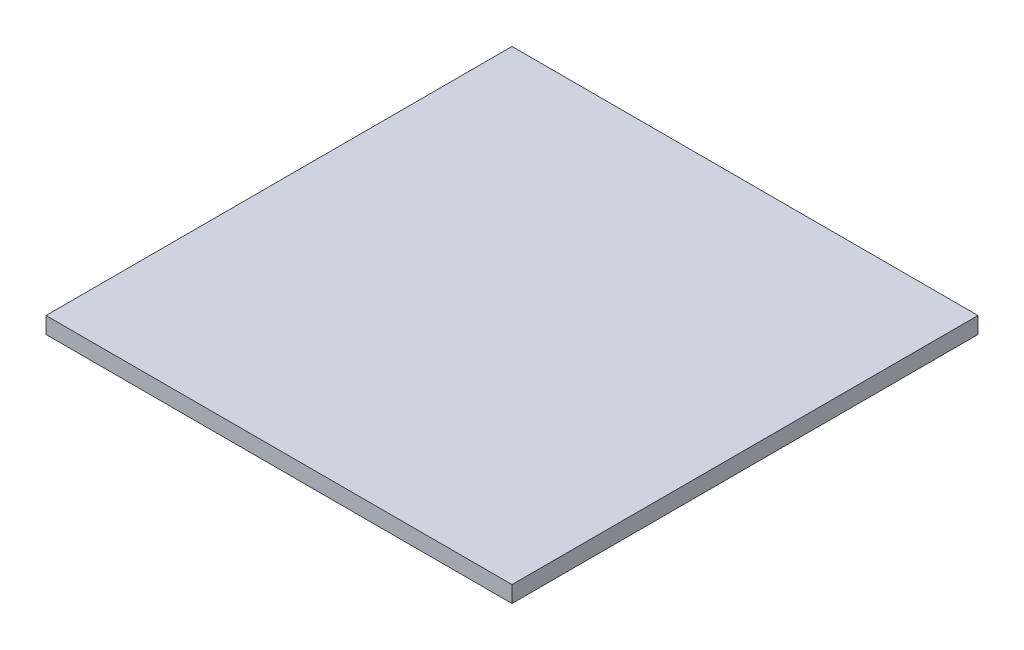
from build123d import *

# Parameters (mm, degrees)
SKETCH1_W           = 170
SKETCH1_H           = 170
BOSS_EXTRUDE3_DEPTH = 6


with BuildPart() as part:
    # Sketch1 → Boss-Extrude3 (new body)
    with BuildSketch(Plane(origin=(0, 0, 0), x_dir=(1, 0, 0), z_dir=(0, 1, 0))):
        with Locations((85, 85)):
            Rectangle(SKETCH1_W, SKETCH1_H)
    extrude(amount=BOSS_EXTRUDE3_DEPTH)


solid = part.part
